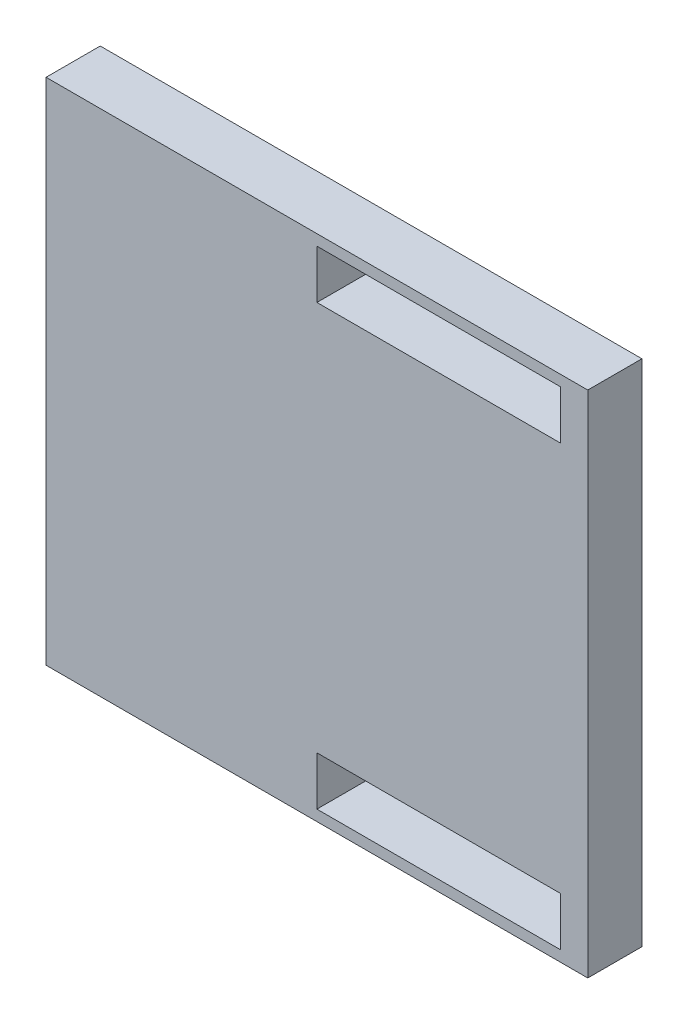
from build123d import *

# Parameters (mm, degrees)
SKETCH1_W           = 100
SKETCH1_H           = 94
BOSS_EXTRUDE1_DEPTH = 10
SKETCH2_W           = 45
SKETCH2_H           = 9
CUT_EXTRUDE1_DEPTH  = 10


with BuildPart() as part:
    # Sketch1 → Boss-Extrude1 (new body)
    with BuildSketch(Plane.XY):
        with Locations((50, -47)):
            Rectangle(SKETCH1_W, SKETCH1_H)
    extrude(amount=BOSS_EXTRUDE1_DEPTH)

    # Sketch2 → Cut-Extrude1 (cut)
    with BuildSketch(Plane(origin=(0, 0, 0), x_dir=(-1, 0, 0), z_dir=(0, 0, -1))):
        with Locations((-72.5, -87.5)):
            Rectangle(SKETCH2_W, SKETCH2_H)
        with Locations((-72.5, -6.5)):
            Rectangle(SKETCH2_W, SKETCH2_H)
    extrude(amount=-CUT_EXTRUDE1_DEPTH, mode=Mode.SUBTRACT)


solid = part.part
